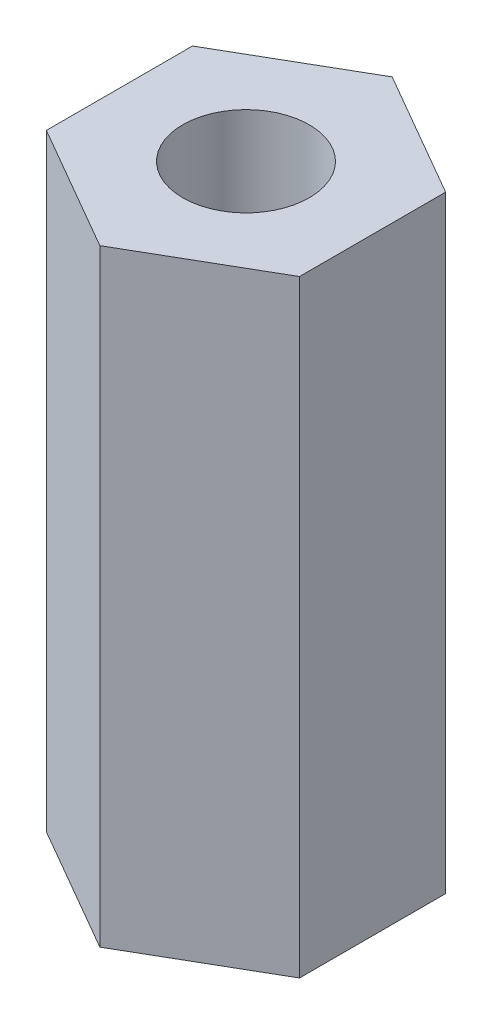
from build123d import *

# Parameters (mm, degrees)
BOSS_EXTRUDE1_DEPTH     = 30.48
CUT_EXTRUDE1_DEPTH      = 32.986188165
CUT_EXTRUDE1_DEPTH_BACK = 32.986188165
SKETCH2_R               = 3.175


with BuildPart() as part:
    # Sketch1 → Boss-Extrude1 (new body)
    with BuildSketch(Plane(origin=(0, 0, 0), x_dir=(1, 0, 0), z_dir=(0, 1, 0))):
        Polygon((0, -7.332348419), (6.35, -3.666174209), (6.35, 3.666174209), (0, 7.332348419), (-6.35, 3.666174209), (-6.35, -3.666174209), align=None)
    extrude(amount=BOSS_EXTRUDE1_DEPTH)

    # Sketch2 → Cut-Extrude1 (cut, two sides: drawn at the far end of the back side and taken through both)
    with BuildSketch(Plane(origin=(0, 30.48, 0), x_dir=(1, 0, 0), z_dir=(0, 1, 0)).offset(-CUT_EXTRUDE1_DEPTH_BACK)):
        with Locations(Location((0, 0, 0), (0, 0, 270))):
            Circle(SKETCH2_R)
    extrude(amount=CUT_EXTRUDE1_DEPTH + CUT_EXTRUDE1_DEPTH_BACK, mode=Mode.SUBTRACT)


solid = part.part
